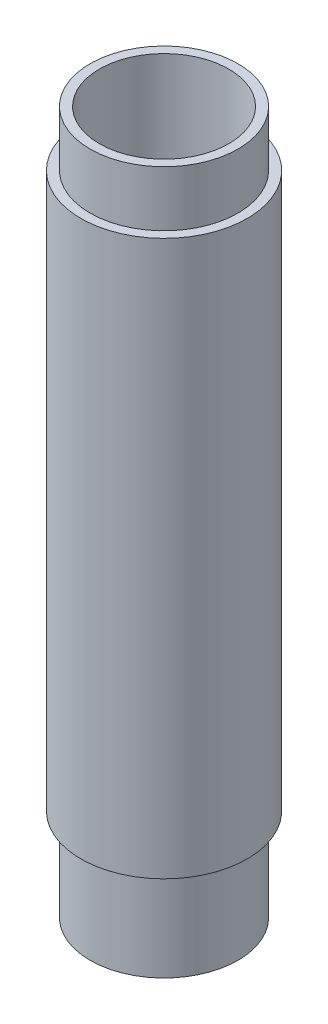
from build123d import *

# Parameters (mm, degrees)
SKETCH2_R                = 8
SKETCH2_R_2              = 7
BOSS_EXTRUDE3_DEPTH      = 15
BOSS_EXTRUDE6_DEPTH      = 11
BOSS_EXTRUDE6_DEPTH_BACK = 40
SKETCH4_R                = 8
SKETCH4_R_2              = 7
SKETCH3_R                = 9
SKETCH3_R_2              = 8
BOSS_EXTRUDE7_DEPTH      = 60
SKETCH6_R                = 8
SKETCH6_R_2              = 7
BOSS_EXTRUDE8_DEPTH      = 31


with BuildPart() as part:
    # Sketch2 → Boss-Extrude3 (new body)
    with BuildSketch(Plane(origin=(0, 0, 0), x_dir=(1, 0, 0), z_dir=(0, 1, 0))):
        with Locations(Location((0, 0, 0), (0, 0, 270))):
            Circle(SKETCH2_R)
        with Locations(Location((0, 0, 0), (0, 0, 270))):
            Circle(SKETCH2_R_2, mode=Mode.SUBTRACT)
    extrude(amount=BOSS_EXTRUDE3_DEPTH)

    # Sketch4 → Boss-Extrude6 (add, two sides: drawn at the far end of the back side and taken through both)
    with BuildSketch(Plane(origin=(0, 45, 0), x_dir=(1, 0, 0), z_dir=(0, 1, 0)).offset(-BOSS_EXTRUDE6_DEPTH_BACK)):
        with Locations(Location((0, 0, 0), (0, 0, 270))):
            Circle(SKETCH4_R)
        with Locations(Location((0, 0, 0), (0, 0, 270))):
            Circle(SKETCH4_R_2, mode=Mode.SUBTRACT)
    extrude(amount=BOSS_EXTRUDE6_DEPTH + BOSS_EXTRUDE6_DEPTH_BACK)

    # Sketch3 → Boss-Extrude7 (add)
    with BuildSketch(Plane(origin=(0, 10, 0), x_dir=(1, 0, 0), z_dir=(0, 1, 0))):
        with Locations(Location((0, 0, 0), (0, 0, 90))):
            Circle(SKETCH3_R)
        with Locations(Location((0, 0, 0), (0, 0, 270))):
            Circle(SKETCH3_R_2, mode=Mode.SUBTRACT)
    extrude(amount=BOSS_EXTRUDE7_DEPTH)

    # Sketch6 → Boss-Extrude8 (add)
    with BuildSketch(Plane(origin=(0, 45, 0), x_dir=(1, 0, 0), z_dir=(0, 1, 0))):
        with Locations(Location((0, 0, 0), (0, 0, 270))):
            Circle(SKETCH6_R)
        with Locations(Location((0, 0, 0), (0, 0, 270))):
            Circle(SKETCH6_R_2, mode=Mode.SUBTRACT)
    extrude(amount=BOSS_EXTRUDE8_DEPTH)


solid = part.part
